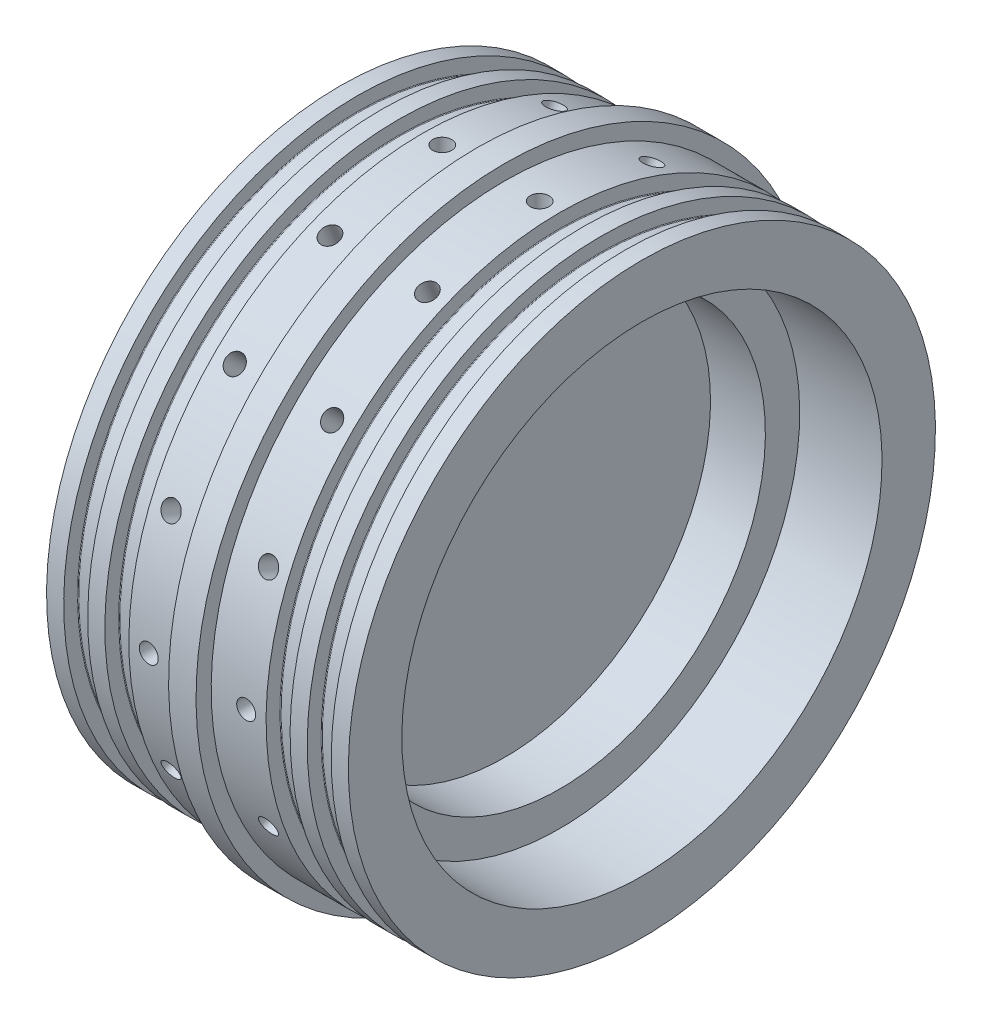
from build123d import *

# Parameters (mm, degrees)
SKETCH8_R          = 44.45
CUT_EXTRUDE1_DEPTH = 15.24
SKETCH15_R         = 38.1
CUT_EXTRUDE2_DEPTH = 10.16
CIRPATTERN1_COUNT  = 16


with BuildPart() as part:
    # Sketch4 → Revolve1 (revolve)
    with BuildSketch(Plane.XY):
        with BuildLine():
            Line((0, 0), (0, 57.15))
            Line((0, 57.15), (5.08, 57.15))
            Line((5.08, 57.15), (5.08, 54.3433))
            Line((5.08, 54.3433), (15.24, 54.3433))
            Line((15.24, 54.3433), (15.24, 51.7906))
            ThreePointArc((15.24, 51.7906), (15.277197439, 51.700797439), (15.367, 51.6636))
            Line((15.367, 51.6636), (19.558, 51.6636))
            ThreePointArc((19.558, 51.6636), (19.647802561, 51.700797439), (19.685, 51.7906))
            Line((19.685, 51.7906), (19.685, 54.3433))
            Line((19.685, 54.3433), (22.86, 54.3433))
            Line((22.86, 54.3433), (22.86, 51.7906))
            ThreePointArc((22.86, 51.7906), (22.897197439, 51.700797439), (22.987, 51.6636))
            Line((22.987, 51.6636), (27.178, 51.6636))
            ThreePointArc((27.178, 51.6636), (27.267802561, 51.700797439), (27.305, 51.7906))
            Line((27.305, 51.7906), (27.305, 54.3433))
            Line((27.305, 54.3433), (30.48, 54.3433))
            Line((30.48, 54.3433), (30.48, 0))
            Line((30.48, 0), (0, 0))
        make_face()
    revolve1 = revolve(axis=Axis((30.48, 0, 0), (-1, 0, 0)))

    # Sketch5 → #6-32 Tapped Hole1 (revolve, cut)
    with BuildSketch(Plane(origin=(11.557, 0, 54.3433), x_dir=(0, -1, 0), z_dir=(1, 0, 0))):
        Polygon((0, 0), (0, 10.97269403), (1.35255, 10.16), (1.35255, 7.62), (1.7526, 7.62), (1.7526, 0), align=None)
    f_6_32_tapped_hole1 = revolve(axis=Axis((11.557, 0, 60.6933), (0, 0, -1)), mode=Mode.SUBTRACT)

    # Sketch8 → Cut-Extrude1 (cut)
    with BuildSketch(Plane(origin=(30.48, 0, 0), x_dir=(0, 0, -1), z_dir=(1, 0, 0))):
        with Locations(Location((0, 0, 0), (0, 0, 90))):
            Circle(SKETCH8_R)
    cut_extrude1 = extrude(amount=-CUT_EXTRUDE1_DEPTH, mode=Mode.SUBTRACT)

    # Sketch15 → Cut-Extrude2 (cut)
    with BuildSketch(Plane(origin=(15.24, 0, 0), x_dir=(0, 0, -1), z_dir=(1, 0, 0))):
        with Locations(Location((0, 0, 0), (0, 0, 90))):
            Circle(SKETCH15_R)
    cut_extrude2 = extrude(amount=-CUT_EXTRUDE2_DEPTH, mode=Mode.SUBTRACT)

    # Mirror1: Revolve1, Cut-Extrude1, Cut-Extrude2 across plane
    add(revolve1.mirror(Plane.ZY.offset(-2.54)))
    add(cut_extrude1.mirror(Plane.ZY.offset(-2.54)), mode=Mode.SUBTRACT)
    add(cut_extrude2.mirror(Plane.ZY.offset(-2.54)), mode=Mode.SUBTRACT)

    # Mirror2: #6-32 Tapped Hole1 across plane
    add(f_6_32_tapped_hole1.mirror(Plane.ZY.offset(-2.54)), mode=Mode.SUBTRACT)

    # CirPattern1: #6-32 Tapped Hole1 ×16 about axis
    cirpattern1_axis = Axis((0, 0, 0), (1, 0, 0))
    for i in range(1, CIRPATTERN1_COUNT):
        add(f_6_32_tapped_hole1.rotate(cirpattern1_axis, i * 360 / CIRPATTERN1_COUNT), mode=Mode.SUBTRACT)

    # CirPattern2 copy 1 sketch → CirPattern2 copy 1 (revolve, cut)
    with BuildSketch(Plane(origin=(-6.477, -20.79628057, 50.206662599), x_dir=(0, -0.9238795325112867, -0.3826834323650897), z_dir=(-1, 0, 0))):
        Polygon((0, 0), (0, -10.97269403), (1.35255, -10.16), (1.35255, -7.62), (1.7526, -7.62), (1.7526, 0), align=None)
    revolve(axis=Axis((-6.477, -23.226320366, 56.073297631), (0, -0.3826834323650897, 0.9238795325112867)), mode=Mode.SUBTRACT)

    # CirPattern2 copy 2 sketch → CirPattern2 copy 2 (revolve, cut)
    with BuildSketch(Plane(origin=(-6.477, -38.426515942, 38.426515942), x_dir=(0, -0.7071067811865476, -0.7071067811865475), z_dir=(-1, 0, 0))):
        Polygon((0, 0), (0, -10.97269403), (1.35255, -10.16), (1.35255, -7.62), (1.7526, -7.62), (1.7526, 0), align=None)
    revolve(axis=Axis((-6.477, -42.916644003, 42.916644003), (0, -0.7071067811865475, 0.7071067811865476)), mode=Mode.SUBTRACT)

    # CirPattern2 copy 3 sketch → CirPattern2 copy 3 (revolve, cut)
    with BuildSketch(Plane(origin=(-6.477, -50.206662599, 20.79628057), x_dir=(0, -0.3826834323650899, -0.9238795325112867), z_dir=(-1, 0, 0))):
        Polygon((0, 0), (0, -10.97269403), (1.35255, -10.16), (1.35255, -7.62), (1.7526, -7.62), (1.7526, 0), align=None)
    revolve(axis=Axis((-6.477, -56.073297631, 23.226320366), (0, -0.9238795325112867, 0.3826834323650899)), mode=Mode.SUBTRACT)

    # CirPattern2 copy 4 sketch → CirPattern2 copy 4 (revolve, cut)
    with BuildSketch(Plane(origin=(-6.477, -54.3433, 0), x_dir=(0, 0, -1), z_dir=(-1, 0, 0))):
        Polygon((0, 0), (0, -10.97269403), (1.35255, -10.16), (1.35255, -7.62), (1.7526, -7.62), (1.7526, 0), align=None)
    revolve(axis=Axis((-6.477, -60.6933, 0), (0, -1, 0)), mode=Mode.SUBTRACT)

    # CirPattern2 copy 5 sketch → CirPattern2 copy 5 (revolve, cut)
    with BuildSketch(Plane(origin=(-6.477, -50.206662599, -20.79628057), x_dir=(0, 0.38268343236508967, -0.9238795325112867), z_dir=(-1, 0, 0))):
        Polygon((0, 0), (0, -10.97269403), (1.35255, -10.16), (1.35255, -7.62), (1.7526, -7.62), (1.7526, 0), align=None)
    revolve(axis=Axis((-6.477, -56.073297631, -23.226320366), (0, -0.9238795325112867, -0.38268343236508967)), mode=Mode.SUBTRACT)

    # CirPattern2 copy 6 sketch → CirPattern2 copy 6 (revolve, cut)
    with BuildSketch(Plane(origin=(-6.477, -38.426515942, -38.426515942), x_dir=(0, 0.7071067811865475, -0.7071067811865476), z_dir=(-1, 0, 0))):
        Polygon((0, 0), (0, -10.97269403), (1.35255, -10.16), (1.35255, -7.62), (1.7526, -7.62), (1.7526, 0), align=None)
    revolve(axis=Axis((-6.477, -42.916644003, -42.916644003), (0, -0.7071067811865476, -0.7071067811865475)), mode=Mode.SUBTRACT)

    # CirPattern2 copy 7 sketch → CirPattern2 copy 7 (revolve, cut)
    with BuildSketch(Plane(origin=(-6.477, -20.79628057, -50.206662599), x_dir=(0, 0.9238795325112867, -0.38268343236508995), z_dir=(-1, 0, 0))):
        Polygon((0, 0), (0, -10.97269403), (1.35255, -10.16), (1.35255, -7.62), (1.7526, -7.62), (1.7526, 0), align=None)
    revolve(axis=Axis((-6.477, -23.226320366, -56.073297631), (0, -0.38268343236508995, -0.9238795325112867)), mode=Mode.SUBTRACT)

    # CirPattern2 copy 8 sketch → CirPattern2 copy 8 (revolve, cut)
    with BuildSketch(Plane(origin=(-6.477, 0, -54.3433), x_dir=(0, 1, 0), z_dir=(-1, 0, 0))):
        Polygon((0, 0), (0, -10.97269403), (1.35255, -10.16), (1.35255, -7.62), (1.7526, -7.62), (1.7526, 0), align=None)
    revolve(axis=Axis((-6.477, 0, -60.6933), (0, 0, -1)), mode=Mode.SUBTRACT)

    # CirPattern2 copy 9 sketch → CirPattern2 copy 9 (revolve, cut)
    with BuildSketch(Plane(origin=(-6.477, 20.79628057, -50.206662599), x_dir=(0, 0.9238795325112868, 0.3826834323650896), z_dir=(-1, 0, 0))):
        Polygon((0, 0), (0, -10.97269403), (1.35255, -10.16), (1.35255, -7.62), (1.7526, -7.62), (1.7526, 0), align=None)
    revolve(axis=Axis((-6.477, 23.226320366, -56.073297631), (0, 0.3826834323650896, -0.9238795325112868)), mode=Mode.SUBTRACT)

    # CirPattern2 copy 10 sketch → CirPattern2 copy 10 (revolve, cut)
    with BuildSketch(Plane(origin=(-6.477, 38.426515942, -38.426515942), x_dir=(0, 0.7071067811865477, 0.7071067811865475), z_dir=(-1, 0, 0))):
        Polygon((0, 0), (0, -10.97269403), (1.35255, -10.16), (1.35255, -7.62), (1.7526, -7.62), (1.7526, 0), align=None)
    revolve(axis=Axis((-6.477, 42.916644003, -42.916644003), (0, 0.7071067811865475, -0.7071067811865477)), mode=Mode.SUBTRACT)

    # CirPattern2 copy 11 sketch → CirPattern2 copy 11 (revolve, cut)
    with BuildSketch(Plane(origin=(-6.477, 50.206662599, -20.79628057), x_dir=(0, 0.38268343236508956, 0.9238795325112868), z_dir=(-1, 0, 0))):
        Polygon((0, 0), (0, -10.97269403), (1.35255, -10.16), (1.35255, -7.62), (1.7526, -7.62), (1.7526, 0), align=None)
    revolve(axis=Axis((-6.477, 56.073297631, -23.226320366), (0, 0.9238795325112868, -0.38268343236508956)), mode=Mode.SUBTRACT)

    # CirPattern2 copy 12 sketch → CirPattern2 copy 12 (revolve, cut)
    with BuildSketch(Plane(origin=(-6.477, 54.3433, 0), x_dir=(0, 0, 1), z_dir=(-1, 0, 0))):
        Polygon((0, 0), (0, -10.97269403), (1.35255, -10.16), (1.35255, -7.62), (1.7526, -7.62), (1.7526, 0), align=None)
    revolve(axis=Axis((-6.477, 60.6933, 0), (0, 1, 0)), mode=Mode.SUBTRACT)

    # CirPattern2 copy 13 sketch → CirPattern2 copy 13 (revolve, cut)
    with BuildSketch(Plane(origin=(-6.477, 50.206662599, 20.79628057), x_dir=(0, -0.38268343236508995, 0.9238795325112866), z_dir=(-1, 0, 0))):
        Polygon((0, 0), (0, -10.97269403), (1.35255, -10.16), (1.35255, -7.62), (1.7526, -7.62), (1.7526, 0), align=None)
    revolve(axis=Axis((-6.477, 56.073297631, 23.226320366), (0, 0.9238795325112866, 0.38268343236508995)), mode=Mode.SUBTRACT)

    # CirPattern2 copy 14 sketch → CirPattern2 copy 14 (revolve, cut)
    with BuildSketch(Plane(origin=(-6.477, 38.426515942, 38.426515942), x_dir=(0, -0.7071067811865474, 0.7071067811865477), z_dir=(-1, 0, 0))):
        Polygon((0, 0), (0, -10.97269403), (1.35255, -10.16), (1.35255, -7.62), (1.7526, -7.62), (1.7526, 0), align=None)
    revolve(axis=Axis((-6.477, 42.916644003, 42.916644003), (0, 0.7071067811865477, 0.7071067811865474)), mode=Mode.SUBTRACT)

    # CirPattern2 copy 15 sketch → CirPattern2 copy 15 (revolve, cut)
    with BuildSketch(Plane(origin=(-6.477, 20.79628057, 50.206662599), x_dir=(0, -0.9238795325112868, 0.3826834323650896), z_dir=(-1, 0, 0))):
        Polygon((0, 0), (0, -10.97269403), (1.35255, -10.16), (1.35255, -7.62), (1.7526, -7.62), (1.7526, 0), align=None)
    revolve(axis=Axis((-6.477, 23.226320366, 56.073297631), (0, 0.3826834323650896, 0.9238795325112868)), mode=Mode.SUBTRACT)

    # CirPattern2 copy 16 sketch → CirPattern2 copy 16 (revolve, cut)
    with BuildSketch(Plane(origin=(11.557, -20.79628057, 50.206662599), x_dir=(0, -0.9238795325112867, -0.3826834323650897), z_dir=(1, 0, 0))):
        Polygon((0, 0), (0, 10.97269403), (1.35255, 10.16), (1.35255, 7.62), (1.7526, 7.62), (1.7526, 0), align=None)
    revolve(axis=Axis((11.557, -23.226320366, 56.073297631), (0, 0.3826834323650897, -0.9238795325112867)), mode=Mode.SUBTRACT)

    # CirPattern2 copy 17 sketch → CirPattern2 copy 17 (revolve, cut)
    with BuildSketch(Plane(origin=(11.557, -38.426515942, 38.426515942), x_dir=(0, -0.7071067811865476, -0.7071067811865475), z_dir=(1, 0, 0))):
        Polygon((0, 0), (0, 10.97269403), (1.35255, 10.16), (1.35255, 7.62), (1.7526, 7.62), (1.7526, 0), align=None)
    revolve(axis=Axis((11.557, -42.916644003, 42.916644003), (0, 0.7071067811865475, -0.7071067811865476)), mode=Mode.SUBTRACT)

    # CirPattern2 copy 18 sketch → CirPattern2 copy 18 (revolve, cut)
    with BuildSketch(Plane(origin=(11.557, -50.206662599, 20.79628057), x_dir=(0, -0.3826834323650899, -0.9238795325112867), z_dir=(1, 0, 0))):
        Polygon((0, 0), (0, 10.97269403), (1.35255, 10.16), (1.35255, 7.62), (1.7526, 7.62), (1.7526, 0), align=None)
    revolve(axis=Axis((11.557, -56.073297631, 23.226320366), (0, 0.9238795325112867, -0.3826834323650899)), mode=Mode.SUBTRACT)

    # CirPattern2 copy 19 sketch → CirPattern2 copy 19 (revolve, cut)
    with BuildSketch(Plane(origin=(11.557, -54.3433, 0), x_dir=(0, 0, -1), z_dir=(1, 0, 0))):
        Polygon((0, 0), (0, 10.97269403), (1.35255, 10.16), (1.35255, 7.62), (1.7526, 7.62), (1.7526, 0), align=None)
    revolve(axis=Axis((11.557, -60.6933, 0), (0, 1, 0)), mode=Mode.SUBTRACT)

    # CirPattern2 copy 20 sketch → CirPattern2 copy 20 (revolve, cut)
    with BuildSketch(Plane(origin=(11.557, -50.206662599, -20.79628057), x_dir=(0, 0.38268343236508967, -0.9238795325112867), z_dir=(1, 0, 0))):
        Polygon((0, 0), (0, 10.97269403), (1.35255, 10.16), (1.35255, 7.62), (1.7526, 7.62), (1.7526, 0), align=None)
    revolve(axis=Axis((11.557, -56.073297631, -23.226320366), (0, 0.9238795325112867, 0.38268343236508967)), mode=Mode.SUBTRACT)

    # CirPattern2 copy 21 sketch → CirPattern2 copy 21 (revolve, cut)
    with BuildSketch(Plane(origin=(11.557, -38.426515942, -38.426515942), x_dir=(0, 0.7071067811865475, -0.7071067811865476), z_dir=(1, 0, 0))):
        Polygon((0, 0), (0, 10.97269403), (1.35255, 10.16), (1.35255, 7.62), (1.7526, 7.62), (1.7526, 0), align=None)
    revolve(axis=Axis((11.557, -42.916644003, -42.916644003), (0, 0.7071067811865476, 0.7071067811865475)), mode=Mode.SUBTRACT)

    # CirPattern2 copy 22 sketch → CirPattern2 copy 22 (revolve, cut)
    with BuildSketch(Plane(origin=(11.557, -20.79628057, -50.206662599), x_dir=(0, 0.9238795325112867, -0.38268343236508995), z_dir=(1, 0, 0))):
        Polygon((0, 0), (0, 10.97269403), (1.35255, 10.16), (1.35255, 7.62), (1.7526, 7.62), (1.7526, 0), align=None)
    revolve(axis=Axis((11.557, -23.226320366, -56.073297631), (0, 0.38268343236508995, 0.9238795325112867)), mode=Mode.SUBTRACT)

    # CirPattern2 copy 23 sketch → CirPattern2 copy 23 (revolve, cut)
    with BuildSketch(Plane(origin=(11.557, 0, -54.3433), x_dir=(0, 1, 0), z_dir=(1, 0, 0))):
        Polygon((0, 0), (0, 10.97269403), (1.35255, 10.16), (1.35255, 7.62), (1.7526, 7.62), (1.7526, 0), align=None)
    revolve(axis=Axis((11.557, 0, -60.6933), (0, 0, 1)), mode=Mode.SUBTRACT)

    # CirPattern2 copy 24 sketch → CirPattern2 copy 24 (revolve, cut)
    with BuildSketch(Plane(origin=(11.557, 20.79628057, -50.206662599), x_dir=(0, 0.9238795325112868, 0.3826834323650896), z_dir=(1, 0, 0))):
        Polygon((0, 0), (0, 10.97269403), (1.35255, 10.16), (1.35255, 7.62), (1.7526, 7.62), (1.7526, 0), align=None)
    revolve(axis=Axis((11.557, 23.226320366, -56.073297631), (0, -0.3826834323650896, 0.9238795325112868)), mode=Mode.SUBTRACT)

    # CirPattern2 copy 25 sketch → CirPattern2 copy 25 (revolve, cut)
    with BuildSketch(Plane(origin=(11.557, 38.426515942, -38.426515942), x_dir=(0, 0.7071067811865477, 0.7071067811865475), z_dir=(1, 0, 0))):
        Polygon((0, 0), (0, 10.97269403), (1.35255, 10.16), (1.35255, 7.62), (1.7526, 7.62), (1.7526, 0), align=None)
    revolve(axis=Axis((11.557, 42.916644003, -42.916644003), (0, -0.7071067811865475, 0.7071067811865477)), mode=Mode.SUBTRACT)

    # CirPattern2 copy 26 sketch → CirPattern2 copy 26 (revolve, cut)
    with BuildSketch(Plane(origin=(11.557, 50.206662599, -20.79628057), x_dir=(0, 0.38268343236508956, 0.9238795325112868), z_dir=(1, 0, 0))):
        Polygon((0, 0), (0, 10.97269403), (1.35255, 10.16), (1.35255, 7.62), (1.7526, 7.62), (1.7526, 0), align=None)
    revolve(axis=Axis((11.557, 56.073297631, -23.226320366), (0, -0.9238795325112868, 0.38268343236508956)), mode=Mode.SUBTRACT)

    # CirPattern2 copy 27 sketch → CirPattern2 copy 27 (revolve, cut)
    with BuildSketch(Plane(origin=(11.557, 54.3433, 0), x_dir=(0, 0, 1), z_dir=(1, 0, 0))):
        Polygon((0, 0), (0, 10.97269403), (1.35255, 10.16), (1.35255, 7.62), (1.7526, 7.62), (1.7526, 0), align=None)
    revolve(axis=Axis((11.557, 60.6933, 0), (0, -1, 0)), mode=Mode.SUBTRACT)

    # CirPattern2 copy 28 sketch → CirPattern2 copy 28 (revolve, cut)
    with BuildSketch(Plane(origin=(11.557, 50.206662599, 20.79628057), x_dir=(0, -0.38268343236508995, 0.9238795325112866), z_dir=(1, 0, 0))):
        Polygon((0, 0), (0, 10.97269403), (1.35255, 10.16), (1.35255, 7.62), (1.7526, 7.62), (1.7526, 0), align=None)
    revolve(axis=Axis((11.557, 56.073297631, 23.226320366), (0, -0.9238795325112866, -0.38268343236508995)), mode=Mode.SUBTRACT)

    # CirPattern2 copy 29 sketch → CirPattern2 copy 29 (revolve, cut)
    with BuildSketch(Plane(origin=(11.557, 38.426515942, 38.426515942), x_dir=(0, -0.7071067811865474, 0.7071067811865477), z_dir=(1, 0, 0))):
        Polygon((0, 0), (0, 10.97269403), (1.35255, 10.16), (1.35255, 7.62), (1.7526, 7.62), (1.7526, 0), align=None)
    revolve(axis=Axis((11.557, 42.916644003, 42.916644003), (0, -0.7071067811865477, -0.7071067811865474)), mode=Mode.SUBTRACT)

    # CirPattern2 copy 30 sketch → CirPattern2 copy 30 (revolve, cut)
    with BuildSketch(Plane(origin=(11.557, 20.79628057, 50.206662599), x_dir=(0, -0.9238795325112868, 0.3826834323650896), z_dir=(1, 0, 0))):
        Polygon((0, 0), (0, 10.97269403), (1.35255, 10.16), (1.35255, 7.62), (1.7526, 7.62), (1.7526, 0), align=None)
    revolve(axis=Axis((11.557, 23.226320366, 56.073297631), (0, -0.3826834323650896, -0.9238795325112868)), mode=Mode.SUBTRACT)


solid = part.part
